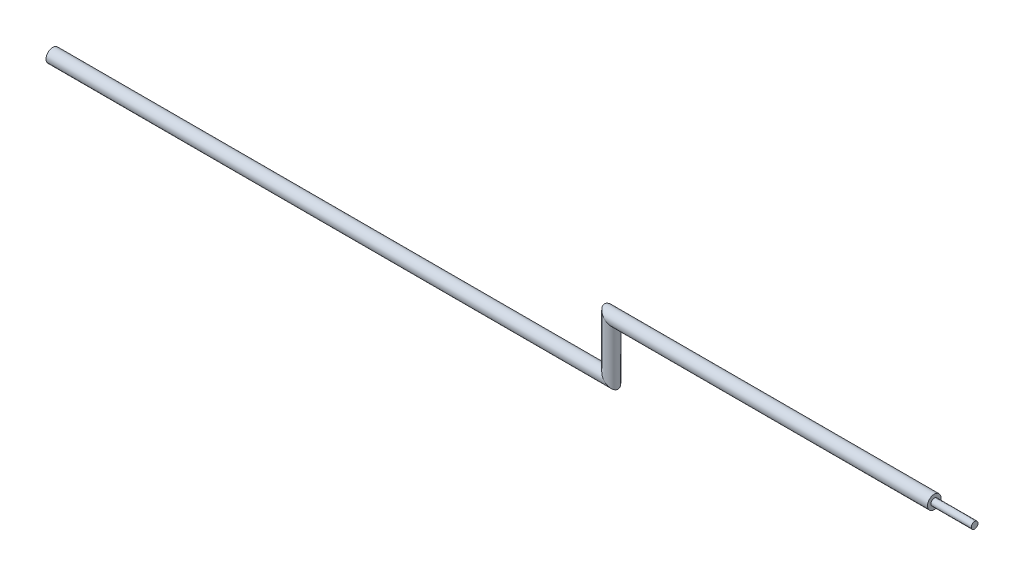
from build123d import *

# Parameters (mm, degrees)
SWEEP1_PROFILE_R    = 6.35
SKETCH20_R          = 3.175
BOSS_EXTRUDE3_DEPTH = 38.1


with BuildPart() as part:
    # Sweep1: sweep along a path in Sketch1
    with BuildLine(Plane.XY) as sweep1_path:
        Line((0, 0), (527.05, 0))
        Line((527.05, 0), (527.05, 50.8))
        Line((527.05, 50.8), (831.85, 50.8))
    # Sweep1 profile (on start of the path) → Sweep1 (sweep)
    with BuildSketch(Plane.YZ):
        Circle(SWEEP1_PROFILE_R)
    sweep(path=sweep1_path.line, transition=Transition.RIGHT)

    # Sketch20 → Boss-Extrude3 (add)
    with BuildSketch(Plane(origin=(831.85, 0, 0), x_dir=(0, 0, -1), z_dir=(1, 0, 0))):
        with Locations(Location((0, 50.8, 0), (0, 0, 270))):
            Circle(SKETCH20_R)
    extrude(amount=BOSS_EXTRUDE3_DEPTH)


solid = part.part
